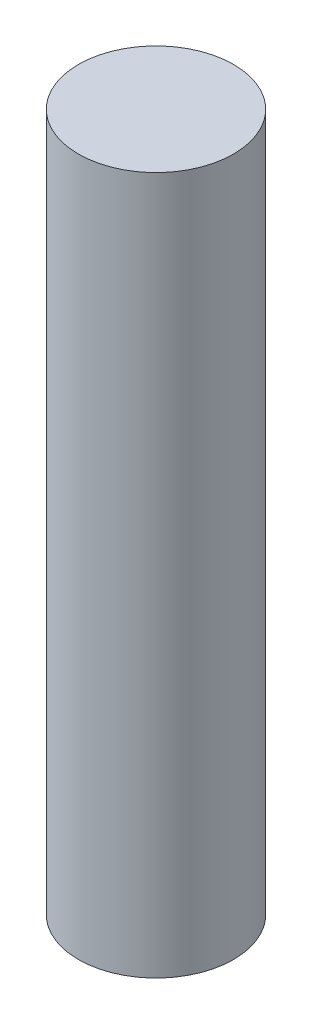
from build123d import *

# Parameters (mm, degrees)
SKETCH2_R           = 4.45
BOSS_EXTRUDE1_DEPTH = 40


with BuildPart() as part:
    # Sketch2 → Boss-Extrude1 (new body)
    with BuildSketch(Plane(origin=(0, 0, 0), x_dir=(1, 0, 0), z_dir=(0, 1, 0))):
        Circle(SKETCH2_R)
    extrude(amount=BOSS_EXTRUDE1_DEPTH)


solid = part.part
